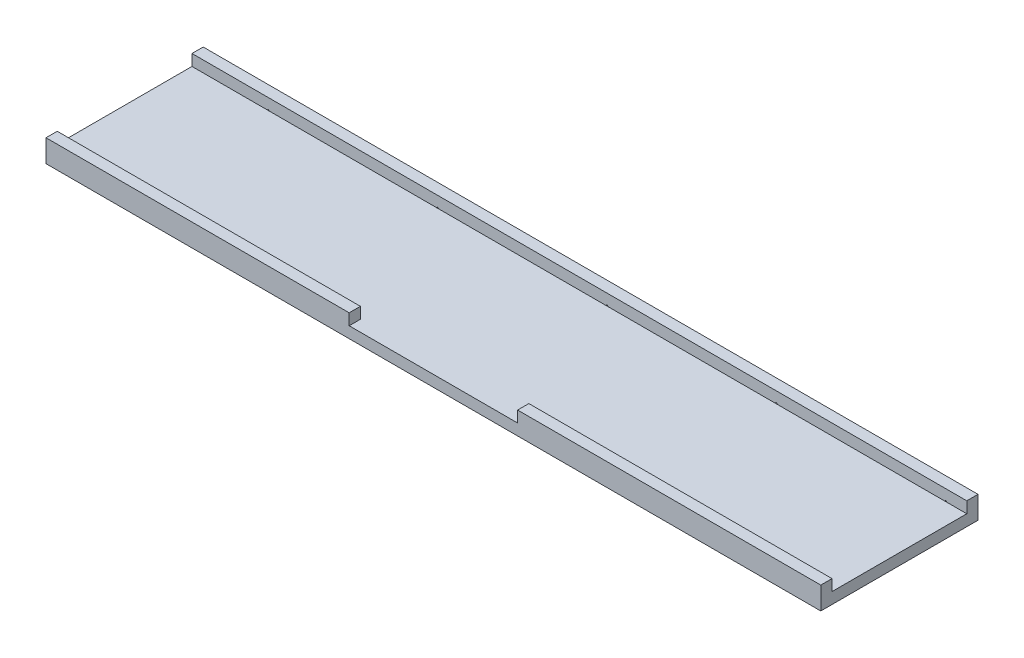
from build123d import *

# Parameters (mm, degrees)
SKETCH1_W           = 345
SKETCH1_H           = 70
BOSS_EXTRUDE1_DEPTH = 5
SKETCH2_W           = 345
SKETCH2_H           = 5
BOSS_EXTRUDE2_DEPTH = 5
SKETCH3_W           = 75
SKETCH3_H           = 5
CUT_EXTRUDE1_DEPTH  = 5
SKETCH4_R           = 0.4
CUT_EXTRUDE2_DEPTH  = 5


with BuildPart() as part:
    # Sketch1 → Boss-Extrude1 (new body)
    with BuildSketch(Plane(origin=(0, 0, 0), x_dir=(1, 0, 0), z_dir=(0, 1, 0))):
        with Locations((172.5, 35)):
            Rectangle(SKETCH1_W, SKETCH1_H)
    extrude(amount=BOSS_EXTRUDE1_DEPTH)

    # Sketch2 → Boss-Extrude2 (add)
    with BuildSketch(Plane(origin=(0, 5, 0), x_dir=(1, 0, 0), z_dir=(0, 1, 0))):
        with Locations((172.5, 67.5)):
            Rectangle(SKETCH2_W, SKETCH2_H)
        with Locations((172.5, 2.5)):
            Rectangle(SKETCH2_W, SKETCH2_H)
    extrude(amount=BOSS_EXTRUDE2_DEPTH)

    # Sketch3 → Cut-Extrude1 (cut)
    with BuildSketch(Plane(origin=(0, 10, 0), x_dir=(1, 0, 0), z_dir=(0, 1, 0))):
        with Locations((172.5, 2.5)):
            Rectangle(SKETCH3_W, SKETCH3_H)
    extrude(amount=-CUT_EXTRUDE1_DEPTH, mode=Mode.SUBTRACT)

    # Sketch4 → Cut-Extrude2 (cut)
    with BuildSketch(Plane(origin=(0, 0, -70), x_dir=(-1, 0, 0), z_dir=(0, 0, -1))):
        with Locations((-335.6, 5)):
            Circle(SKETCH4_R)
        with Locations((-260.2, 5)):
            Circle(SKETCH4_R)
        with Locations((-184.8, 5)):
            Circle(SKETCH4_R)
        with Locations((-109.4, 5)):
            Circle(SKETCH4_R)
        with Locations((-34, 5)):
            Circle(SKETCH4_R)
    extrude(amount=-CUT_EXTRUDE2_DEPTH, mode=Mode.SUBTRACT)


solid = part.part
